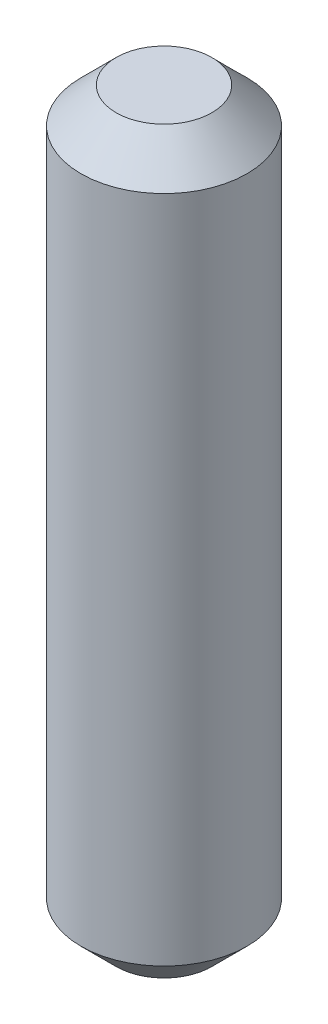
from build123d import *

# Parameters (mm, degrees)
SKETCH2_R           = 2.9972
BOSS_EXTRUDE1_DEPTH = 26.67
CHAMFER1_SIZE       = 1.27


with BuildPart() as part:
    # Sketch2 → Boss-Extrude1 (new body)
    with BuildSketch(Plane(origin=(0, 0, 0), x_dir=(1, 0, 0), z_dir=(0, 1, 0))):
        with Locations(Location((0, 0, 0), (0, 0, 270))):
            Circle(SKETCH2_R)
    extrude(amount=BOSS_EXTRUDE1_DEPTH)

    # Chamfer1
    chamfer1_edges = [part.edges().sort_by_distance(p)[0] for p in [
        (0, 0, -2.9972),
        (0, 26.67, -2.9972),
    ]]
    chamfer(chamfer1_edges, length=CHAMFER1_SIZE)


solid = part.part
